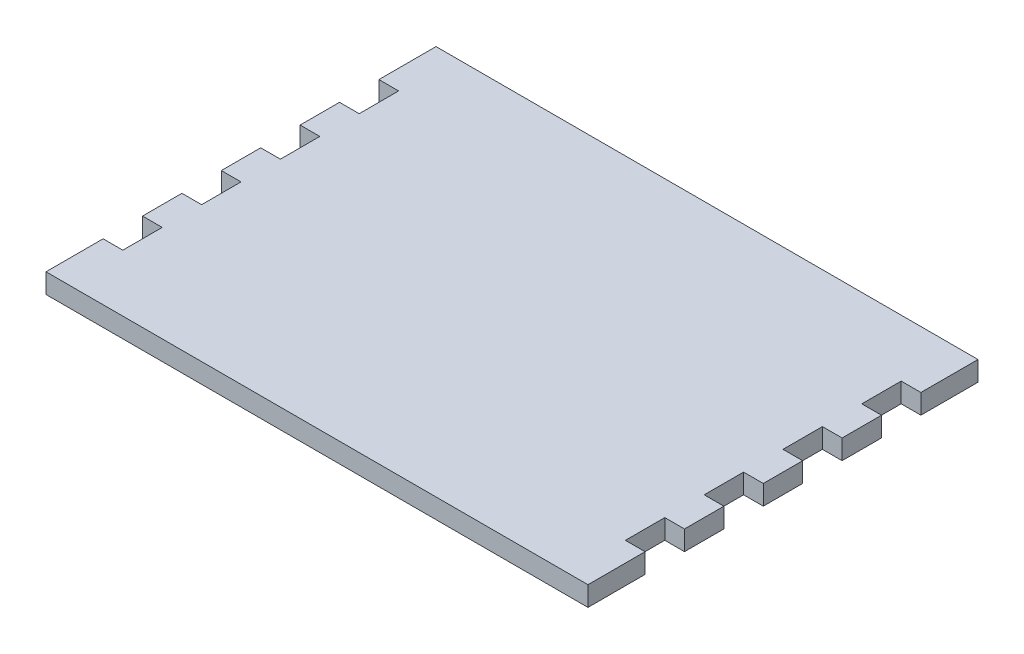
from build123d import *

# Parameters (mm, degrees)
BOSS_EXTRUDE1_DEPTH = 3.175


with BuildPart() as part:
    # Sketch1 → Boss-Extrude1 (new body)
    with BuildSketch(Plane(origin=(0, 0, 0), x_dir=(1, 0, 0), z_dir=(0, 1, 0))):
        Polygon((0, 0), (0, 9.205896498), (3.175, 9.205896498), (3.175, 15.555896498), (0, 15.555896498), (0, 21.905896498), (3.175, 21.905896498), (3.175, 28.255896498), (0, 28.255896498), (0, 34.605896498), (3.175, 34.605896498), (3.175, 40.955896498), (0, 40.955896498), (0, 47.305896498), (3.175, 47.305896498), (3.175, 53.655896498), (0, 53.655896498), (0, 62.861792996), (3.175, 62.861792996), (84.175, 62.861792996), (87.35, 62.861792996), (87.35, 53.655896498), (84.175, 53.655896498), (84.175, 47.305896498), (87.35, 47.305896498), (87.35, 40.955896498), (84.175, 40.955896498), (84.175, 34.605896498), (87.35, 34.605896498), (87.35, 28.255896498), (84.175, 28.255896498), (84.175, 21.905896498), (87.35, 21.905896498), (87.35, 15.555896498), (84.175, 15.555896498), (84.175, 9.205896498), (87.35, 9.205896498), (87.35, 0), (84.175, 0), (3.175, 0), align=None)
    extrude(amount=BOSS_EXTRUDE1_DEPTH)


solid = part.part
